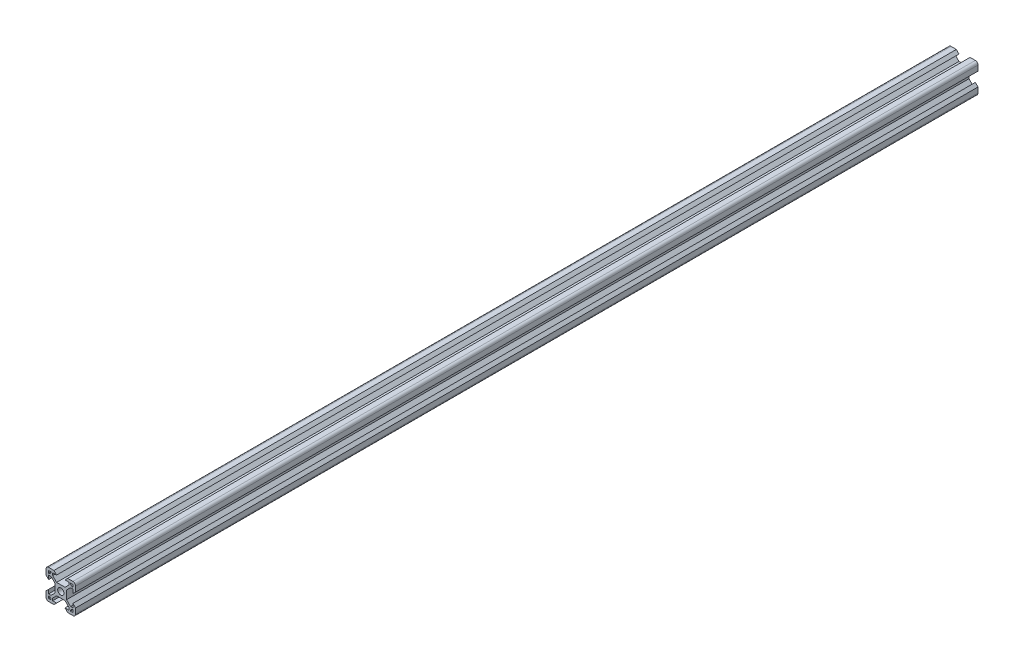
from build123d import *

# Parameters (mm, degrees)
SKETCH1_R      = 2.1
EXTRUDE1_DEPTH = 304.8


with BuildPart() as part:
    # Sketch1 → Extrude1 (new, symmetric)
    with BuildSketch(Plane.XY):
        with BuildLine():
            Line((-3.900660172, 0), (-3.900660172, -2.84))
            Line((-3.900660172, -2.84), (-6.56, -5.499339828))
            Line((-6.56, -5.499339828), (-8.2, -5.499339828))
            Line((-8.2, -5.499339828), (-8.2, -2.84))
            Line((-8.2, -2.84), (-10, -4.64))
            Line((-10, -4.64), (-10, -8.2))
            ThreePointArc((-10, -8.2), (-9.472792206, -9.472792206), (-8.2, -10))
            Line((-8.2, -10), (-4.64, -10))
            Line((-4.64, -10), (-2.84, -8.2))
            Line((-2.84, -8.2), (-5.499339828, -8.2))
            Line((-5.499339828, -8.2), (-5.499339828, -6.56))
            Line((-5.499339828, -6.56), (-2.84, -3.900660172))
            Line((-2.84, -3.900660172), (0, -3.900660172))
            Line((0, -3.900660172), (2.84, -3.900660172))
            Line((2.84, -3.900660172), (5.499339828, -6.56))
            Line((5.499339828, -6.56), (5.499339828, -8.2))
            Line((5.499339828, -8.2), (2.84, -8.2))
            Line((2.84, -8.2), (4.64, -10))
            Line((4.64, -10), (8.2, -10))
            ThreePointArc((8.2, -10), (9.472792206, -9.472792206), (10, -8.2))
            Line((10, -8.2), (10, -4.64))
            Line((10, -4.64), (8.2, -2.84))
            Line((8.2, -2.84), (8.2, -5.499339828))
            Line((8.2, -5.499339828), (6.56, -5.499339828))
            Line((6.56, -5.499339828), (3.900660172, -2.84))
            Line((3.900660172, -2.84), (3.900660172, 0))
            Line((3.900660172, 0), (3.900660172, 2.84))
            Line((3.900660172, 2.84), (6.56, 5.499339828))
            Line((6.56, 5.499339828), (8.2, 5.499339828))
            Line((8.2, 5.499339828), (8.2, 2.84))
            Line((8.2, 2.84), (10, 4.64))
            Line((10, 4.64), (10, 8.2))
            ThreePointArc((10, 8.2), (9.472792206, 9.472792206), (8.2, 10))
            Line((8.2, 10), (4.64, 10))
            Line((4.64, 10), (2.84, 8.2))
            Line((2.84, 8.2), (5.499339828, 8.2))
            Line((5.499339828, 8.2), (5.499339828, 6.56))
            Line((5.499339828, 6.56), (2.84, 3.900660172))
            Line((2.84, 3.900660172), (0, 3.900660172))
            Line((0, 3.900660172), (-2.84, 3.900660172))
            Line((-2.84, 3.900660172), (-5.499339828, 6.56))
            Line((-5.499339828, 6.56), (-5.499339828, 8.2))
            Line((-5.499339828, 8.2), (-2.84, 8.2))
            Line((-2.84, 8.2), (-4.64, 10))
            Line((-4.64, 10), (-8.2, 10))
            ThreePointArc((-8.2, 10), (-9.472792206, 9.472792206), (-10, 8.2))
            Line((-10, 8.2), (-10, 4.64))
            Line((-10, 4.64), (-8.2, 2.84))
            Line((-8.2, 2.84), (-8.2, 5.499339828))
            Line((-8.2, 5.499339828), (-6.56, 5.499339828))
            Line((-6.56, 5.499339828), (-3.900660172, 2.84))
            Line((-3.900660172, 2.84), (-3.900660172, 0))
        make_face()
        with Locations(Location((0, 0, 0), (0, 0, 180))):
            Circle(SKETCH1_R, mode=Mode.SUBTRACT)
        Polygon((-8.2, -8.2), (-8.2, -6.569339828), (-7.63, -6.569339828), (-6.569339828, -7.63), (-6.569339828, -8.2), align=None, mode=Mode.SUBTRACT)
        Polygon((-8.2, 6.569339828), (-8.2, 8.2), (-6.569339828, 8.2), (-6.569339828, 7.63), (-7.63, 6.569339828), align=None, mode=Mode.SUBTRACT)
        Polygon((6.569339828, 8.2), (8.2, 8.2), (8.2, 6.569339828), (7.63, 6.569339828), (6.569339828, 7.63), align=None, mode=Mode.SUBTRACT)
        Polygon((8.2, -6.569339828), (8.2, -8.2), (6.569339828, -8.2), (6.569339828, -7.63), (7.63, -6.569339828), align=None, mode=Mode.SUBTRACT)
    extrude(amount=EXTRUDE1_DEPTH, both=True)


solid = part.part
